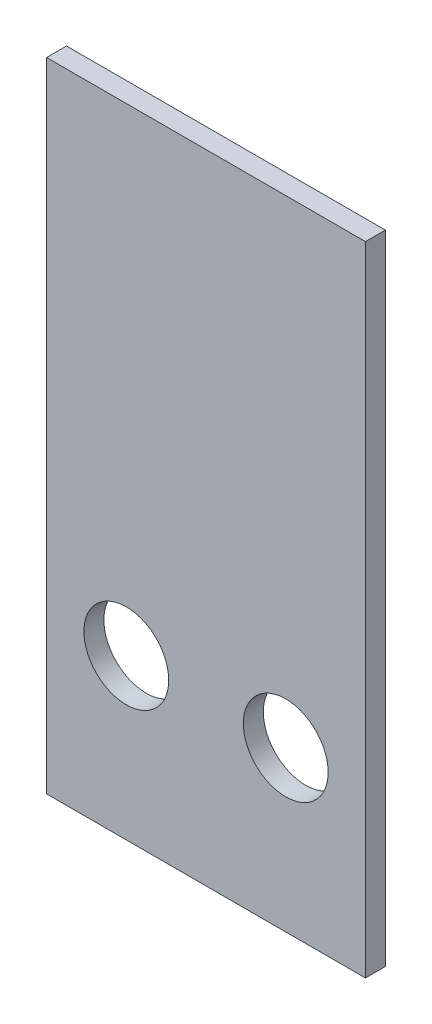
from build123d import *

# Parameters (mm, degrees)
SKETCH1_W               = 25.4
SKETCH1_H               = 50.8
BOSS_EXTRUDE1_DEPTH     = 1.5875
F_1_4_CLEARANCE_HOLE1_D = 6.7564


with BuildPart() as part:
    # Sketch1 → Boss-Extrude1 (new body)
    with BuildSketch(Plane.XY):
        Rectangle(SKETCH1_W, SKETCH1_H)
    extrude(amount=BOSS_EXTRUDE1_DEPTH)

    # 1/4 Clearance Hole1 (through all)
    with Locations(Plane.XY.offset(1.5875)):
        with Locations((-6.35, -12.7), (6.35, -12.7)):
            Hole(F_1_4_CLEARANCE_HOLE1_D / 2)


solid = part.part
